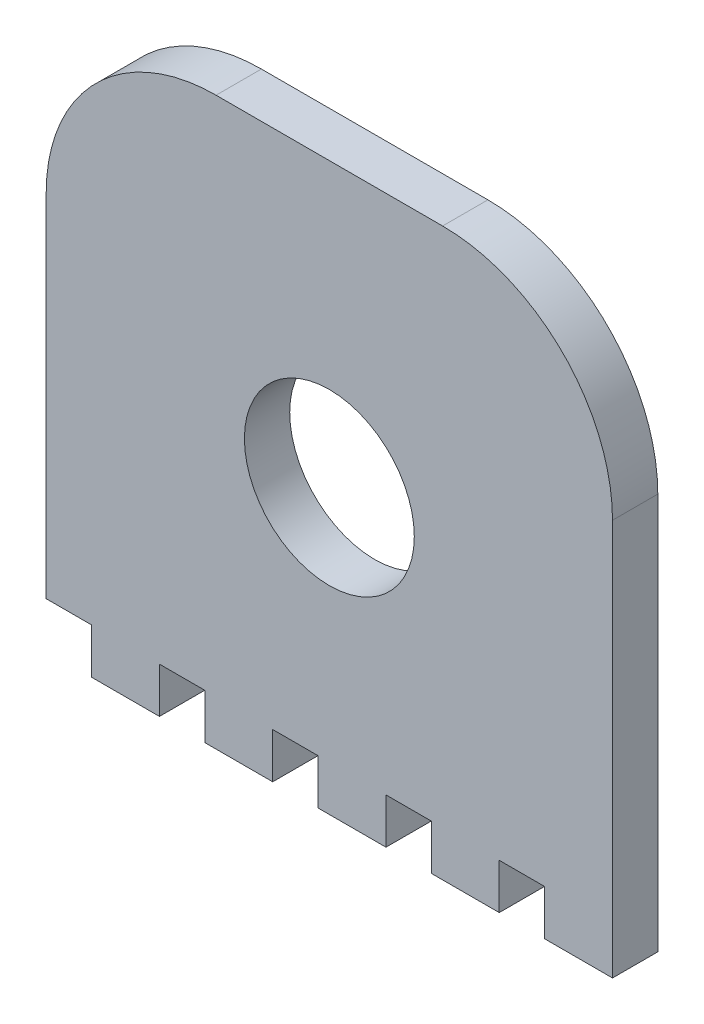
from build123d import *

# Parameters (mm, degrees)
SKETCH1_W           = 50
SKETCH1_H           = 50
BOSS_EXTRUDE1_DEPTH = 4
SKETCH2_W           = 4
SKETCH2_H           = 4
CUT_EXTRUDE1_DEPTH  = 4
SKETCH3_R           = 7.5
CUT_EXTRUDE2_DEPTH  = 4
FILLET1_R           = 15


with BuildPart() as part:
    # Sketch1 → Boss-Extrude1 (new body)
    with BuildSketch(Plane.XY):
        Rectangle(SKETCH1_W, SKETCH1_H)
    extrude(amount=BOSS_EXTRUDE1_DEPTH)

    # Sketch2 → Cut-Extrude1 (cut)
    with BuildSketch(Plane.XY):
        with Locations((-23, -23)):
            Rectangle(SKETCH2_W, SKETCH2_H)
        with Locations((-13, -23)):
            Rectangle(SKETCH2_W, SKETCH2_H)
        with Locations((-3, -23)):
            Rectangle(SKETCH2_W, SKETCH2_H)
        with Locations((7, -23)):
            Rectangle(SKETCH2_W, SKETCH2_H)
        with Locations((17, -23)):
            Rectangle(SKETCH2_W, SKETCH2_H)
    extrude(amount=CUT_EXTRUDE1_DEPTH, mode=Mode.SUBTRACT)

    # Sketch3 → Cut-Extrude2 (cut)
    with BuildSketch(Plane.XY):
        Circle(SKETCH3_R)
    extrude(amount=CUT_EXTRUDE2_DEPTH, mode=Mode.SUBTRACT)

    # Fillet1
    fillet1_edges = [part.edges().sort_by_distance(p)[0] for p in [
        (-25, 25, 2),
        (25, 25, 2),
    ]]
    fillet(fillet1_edges, radius=FILLET1_R)


solid = part.part
